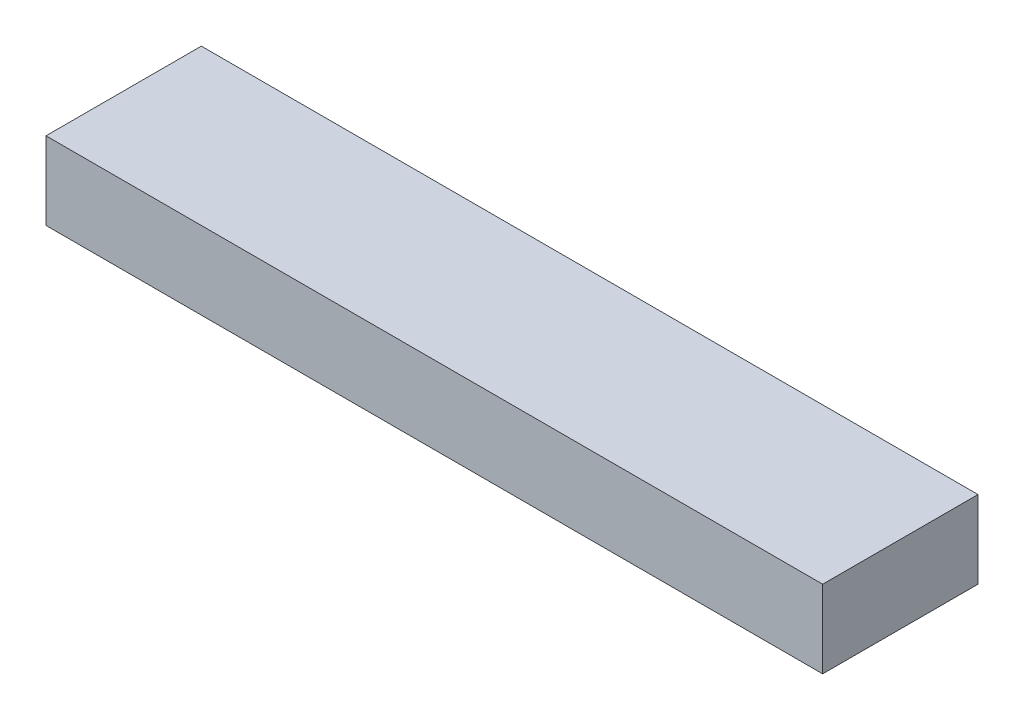
from build123d import *

# Parameters (mm, degrees)
SKETCH1_W           = 127
SKETCH1_H           = 25.4
BOSS_EXTRUDE1_DEPTH = 12.7


with BuildPart() as part:
    # Sketch1 → Boss-Extrude1 (new body)
    with BuildSketch(Plane(origin=(0, 0, 0), x_dir=(1, 0, 0), z_dir=(0, 1, 0))):
        Rectangle(SKETCH1_W, SKETCH1_H)
    extrude(amount=BOSS_EXTRUDE1_DEPTH)


solid = part.part
